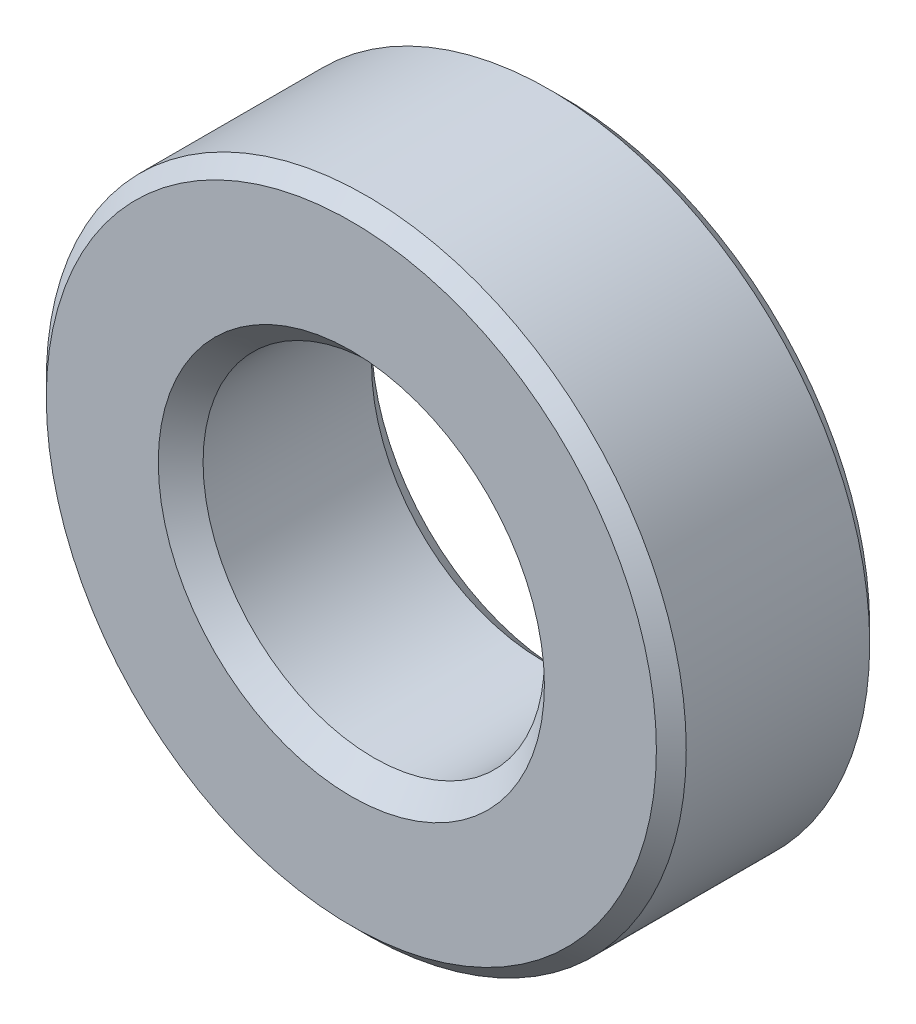
from build123d import *

# Parameters (mm, degrees)
BOSS_EXTRUDE1_DEPTH      = 1
BOSS_EXTRUDE1_DEPTH_BACK = 1
SKETCH3_R                = 3
SKETCH3_R_2              = 1.6
CHAMFER1_SIZE            = 0.14
CHAMFER2_SIZE            = 0.21


with BuildPart() as part:
    # Sketch3 → Boss-Extrude1 (new, two sides: drawn at the far end of the back side and taken through both)
    with BuildSketch(Plane.XY.offset(-BOSS_EXTRUDE1_DEPTH_BACK)):
        Circle(SKETCH3_R)
        Circle(SKETCH3_R_2, mode=Mode.SUBTRACT)
    extrude(amount=BOSS_EXTRUDE1_DEPTH + BOSS_EXTRUDE1_DEPTH_BACK)

    # Chamfer1
    chamfer1_edges = [part.edges().sort_by_distance(p)[0] for p in [
        (-3, 0, -1),
        (-3, 0, 1),
    ]]
    chamfer(chamfer1_edges, length=CHAMFER1_SIZE)

    # Chamfer2
    chamfer2_edges = [part.edges().sort_by_distance(p)[0] for p in [
        (-1.6, 0, -1),
        (-1.6, 0, 1),
    ]]
    chamfer(chamfer2_edges, length=CHAMFER2_SIZE)


solid = part.part
